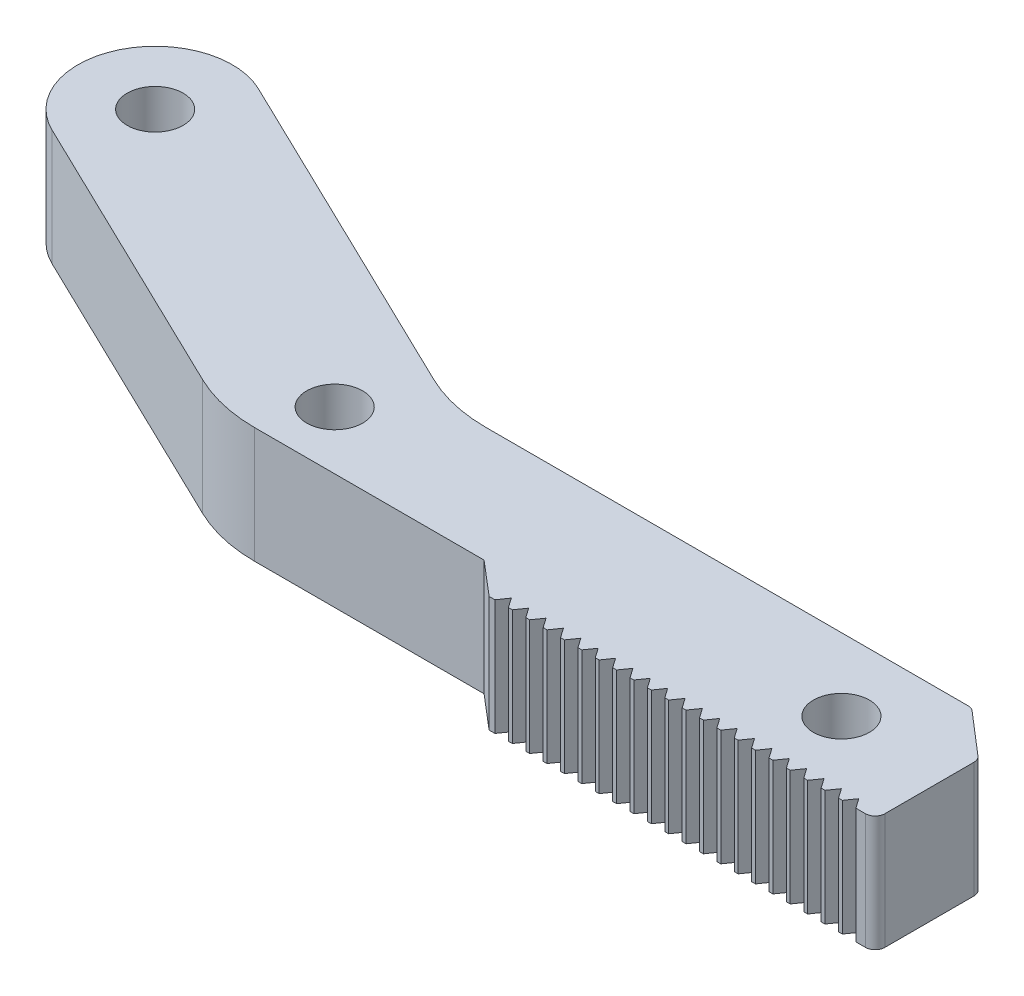
from build123d import *

# Parameters (mm, degrees)
CROQUIS_BASE_R          = 1.45
SALIENTE_EXTRUIR1_DEPTH = 6
REDONDEO2_R             = 8
REDONDEO1_R             = 0.5


with BuildPart() as part:
    # Croquis base → Saliente-Extruir1 (new body)
    with BuildSketch(Plane(origin=(0, 0, 0), x_dir=(1, 0, 0), z_dir=(0, 1, 0))):
        with BuildLine():
            Line((-16.24362, -3), (-5.50562, -3))
            Line((-5.50562, -3), (-3.74362, -4.5))
            Line((-3.74362, -4.5), (-3.64362, -4.5))
            Line((-3.64362, -4.5), (-3.44362, -4.5))
            Line((-3.44362, -4.5), (-3.09362, -4))
            Line((-3.09362, -4), (-2.74362, -4.5))
            Line((-2.74362, -4.5), (-2.54362, -4.5))
            Line((-2.54362, -4.5), (-2.19362, -4))
            Line((-2.19362, -4), (-1.84362, -4.5))
            Line((-1.84362, -4.5), (-1.64362, -4.5))
            Line((-1.64362, -4.5), (-1.29362, -4))
            Line((-1.29362, -4), (-0.94362, -4.5))
            Line((-0.94362, -4.5), (-0.74362, -4.5))
            Line((-0.74362, -4.5), (-0.39362, -4))
            Line((-0.39362, -4), (-0.04362, -4.5))
            Line((-0.04362, -4.5), (0.15638, -4.5))
            Line((0.15638, -4.5), (0.50638, -4))
            Line((0.50638, -4), (0.85638, -4.5))
            Line((0.85638, -4.5), (1.05638, -4.5))
            Line((1.05638, -4.5), (1.40638, -4))
            Line((1.40638, -4), (1.75638, -4.5))
            Line((1.75638, -4.5), (1.95638, -4.5))
            Line((1.95638, -4.5), (2.30638, -4))
            Line((2.30638, -4), (2.65638, -4.5))
            Line((2.65638, -4.5), (2.85638, -4.5))
            Line((2.85638, -4.5), (3.20638, -4))
            Line((3.20638, -4), (3.55638, -4.5))
            Line((3.55638, -4.5), (3.75638, -4.5))
            Line((3.75638, -4.5), (4.10638, -4))
            Line((4.10638, -4), (4.45638, -4.5))
            Line((4.45638, -4.5), (4.65638, -4.5))
            Line((4.65638, -4.5), (5.00638, -4))
            Line((5.00638, -4), (5.35638, -4.5))
            Line((5.35638, -4.5), (5.55638, -4.5))
            Line((5.55638, -4.5), (5.90638, -4))
            Line((5.90638, -4), (6.25638, -4.5))
            Line((6.25638, -4.5), (6.45638, -4.5))
            Line((6.45638, -4.5), (6.80638, -4))
            Line((6.80638, -4), (7.15638, -4.5))
            Line((7.15638, -4.5), (7.35638, -4.5))
            Line((7.35638, -4.5), (7.70638, -4))
            Line((7.70638, -4), (8.05638, -4.5))
            Line((8.05638, -4.5), (8.25638, -4.5))
            Line((8.25638, -4.5), (8.60638, -4))
            Line((8.60638, -4), (8.95638, -4.5))
            Line((8.95638, -4.5), (9.15638, -4.5))
            Line((9.15638, -4.5), (9.50638, -4))
            Line((9.50638, -4), (9.85638, -4.5))
            Line((9.85638, -4.5), (10.05638, -4.5))
            Line((10.05638, -4.5), (10.40638, -4))
            Line((10.40638, -4), (10.75638, -4.5))
            Line((10.75638, -4.5), (10.95638, -4.5))
            Line((10.95638, -4.5), (11.30638, -4))
            Line((11.30638, -4), (11.65638, -4.5))
            Line((11.65638, -4.5), (11.85638, -4.5))
            Line((11.85638, -4.5), (12.20638, -4))
            Line((12.20638, -4), (12.55638, -4.5))
            Line((12.55638, -4.5), (12.75638, -4.5))
            Line((12.75638, -4.5), (13.10638, -4))
            Line((13.10638, -4), (13.45638, -4.5))
            Line((13.45638, -4.5), (13.65638, -4.5))
            Line((13.65638, -4.5), (14.00638, -4))
            Line((14.00638, -4), (14.35638, -4.5))
            Line((14.35638, -4.5), (14.55638, -4.5))
            Line((14.55638, -4.5), (14.90638, -4))
            Line((14.90638, -4), (15.25638, -4.5))
            Line((15.25638, -4.5), (16.25638, -4.5))
            Line((16.25638, -4.5), (16.25638, -3))
            Line((16.25638, -3), (16.25638, 0.85))
            Line((16.25638, 0.85), (13.75638, 3))
            Line((13.75638, 3), (-13.258896681, 3))
            Line((-13.258896681, 3), (-32.509077494, 12.30588853))
            ThreePointArc((-32.509077494, 12.30588853), (-37.851276, 10.445535036), (-35.990922506, 5.10333653))
            Line((-35.990922506, 5.10333653), (-19.228343319, -3))
            Line((-19.228343319, -3), (-16.24362, -3))
        make_face()
        with Locations((-16.24362, 0)):
            Circle(CROQUIS_BASE_R, mode=Mode.SUBTRACT)
        with Locations((10.75638, -0.75)):
            Circle(CROQUIS_BASE_R, mode=Mode.SUBTRACT)
        with Locations((-34.25, 8.70461253)):
            Circle(CROQUIS_BASE_R, mode=Mode.SUBTRACT)
    extrude(amount=SALIENTE_EXTRUIR1_DEPTH)

    # Redondeo2
    redondeo2_edges = [part.edges().sort_by_distance(p)[0] for p in [
        (-13.258896681, 3, -3),
        (-19.228343319, 3, 3),
    ]]
    fillet(redondeo2_edges, radius=REDONDEO2_R)

    # Redondeo1
    redondeo1_edges = [part.edges().sort_by_distance(p)[0] for p in [
        (16.25638, 3, 4.5),
        (13.75638, 3, -3),
        (16.25638, 3, -0.85),
    ]]
    fillet(redondeo1_edges, radius=REDONDEO1_R)


solid = part.part
